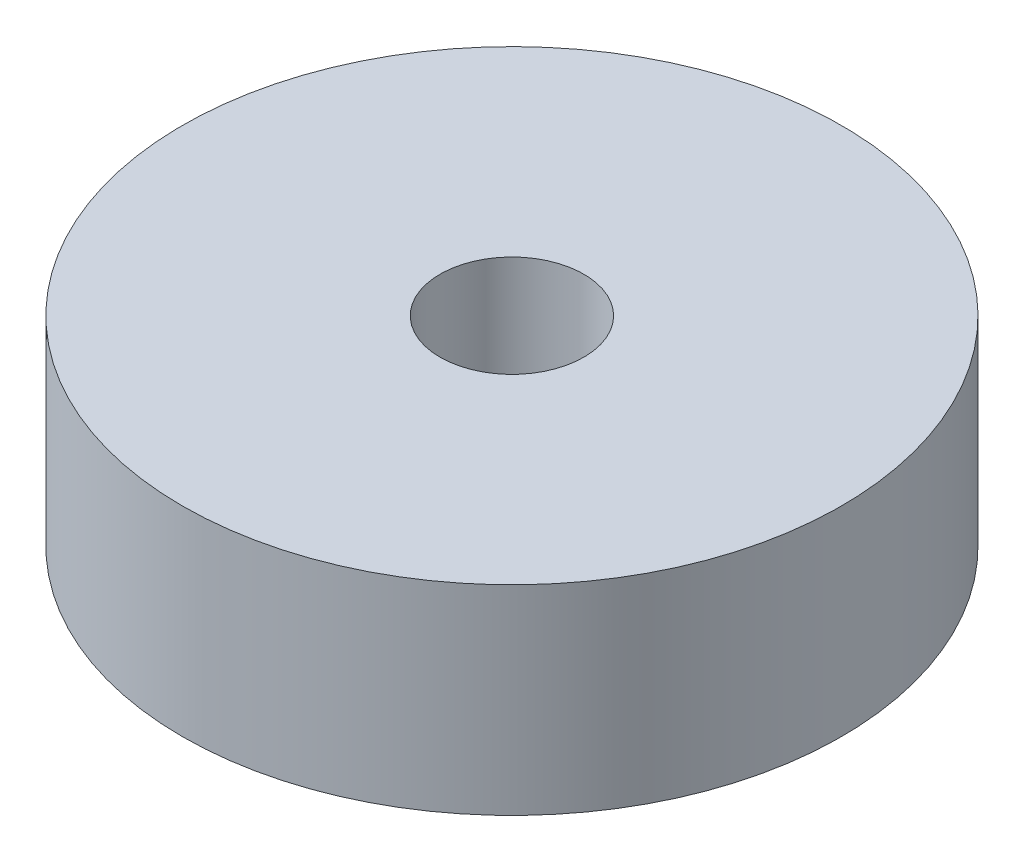
from build123d import *

# Parameters (mm, degrees)
SKETCH1_R           = 10.475
SKETCH1_R_2         = 7.62
BOSS_EXTRUDE1_DEPTH = 6.35
SKETCH1_3_R         = 7.62
SKETCH1_3_R_2       = 2.286
BOSS_EXTRUDE2_DEPTH = 6.35


with BuildPart() as part:
    # Sketch1 → Boss-Extrude1 (new body)
    with BuildSketch(Plane(origin=(0, 0, 0), x_dir=(1, 0, 0), z_dir=(0, 1, 0))):
        Circle(SKETCH1_R)
        Circle(SKETCH1_R_2, mode=Mode.SUBTRACT)
    extrude(amount=BOSS_EXTRUDE1_DEPTH)

    # Sketch1<3> → Boss-Extrude2 (add)
    with BuildSketch(Plane(origin=(0, 0, 0), x_dir=(1, 0, 0), z_dir=(0, 1, 0))):
        Circle(SKETCH1_3_R)
        Circle(SKETCH1_3_R_2, mode=Mode.SUBTRACT)
    extrude(amount=BOSS_EXTRUDE2_DEPTH)


solid = part.part
